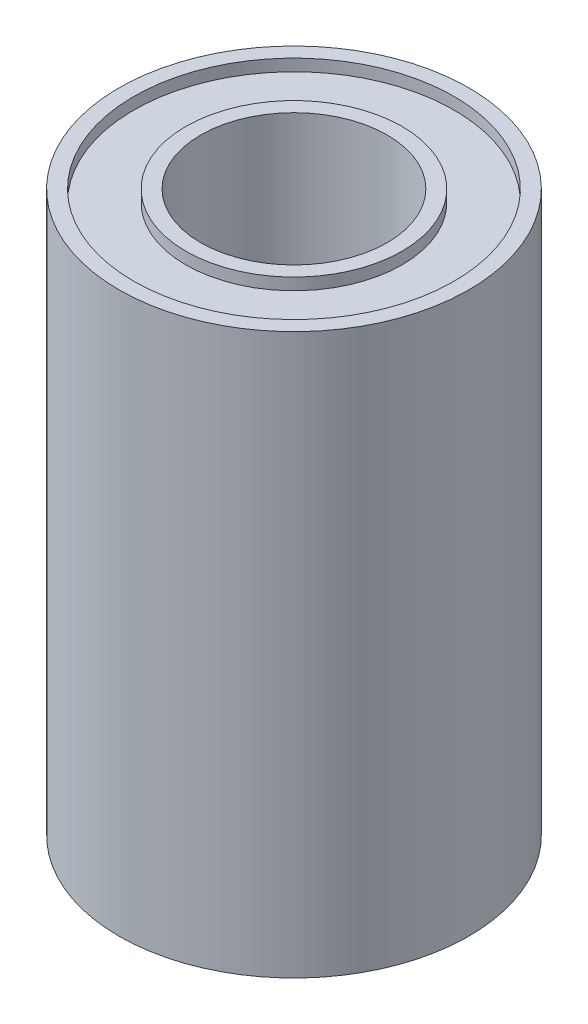
from build123d import *

# Parameters (mm, degrees)
SKETCH1_R           = 7.5
SKETCH1_R_2         = 4
BOSS_EXTRUDE1_DEPTH = 12
SKETCH2_R           = 6.865
SKETCH2_R_2         = 4.635
CUT_EXTRUDE1_DEPTH  = 0.508


with BuildPart() as part:
    # Sketch1 → Boss-Extrude1 (new, symmetric)
    with BuildSketch(Plane(origin=(0, 0, 0), x_dir=(1, 0, 0), z_dir=(0, 1, 0))):
        with Locations(Location((0, 0, 0), (0, 0, 270))):
            Circle(SKETCH1_R)
        with Locations(Location((0, 0, 0), (0, 0, 270))):
            Circle(SKETCH1_R_2, mode=Mode.SUBTRACT)
    extrude(amount=BOSS_EXTRUDE1_DEPTH, both=True)

    # Sketch2 → Cut-Extrude1 (cut)
    with BuildSketch(Plane(origin=(0, 12, 0), x_dir=(1, 0, 0), z_dir=(0, 1, 0))):
        with Locations(Location((0, 0, 0), (0, 0, 270))):
            Circle(SKETCH2_R)
        with Locations(Location((0, 0, 0), (0, 0, 270))):
            Circle(SKETCH2_R_2, mode=Mode.SUBTRACT)
    cut_extrude1 = extrude(amount=-CUT_EXTRUDE1_DEPTH, mode=Mode.SUBTRACT)

    # Mirror1: Cut-Extrude1 across plane
    add(cut_extrude1.mirror(Plane.ZX), mode=Mode.SUBTRACT)


solid = part.part
